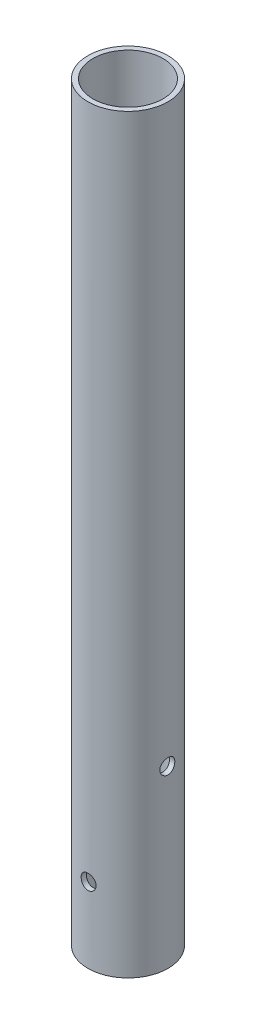
from build123d import *

# Parameters (mm, degrees)
SKETCH_1_R               = 8
SKETCH_1_R_2             = 7
EXTRUDE_1_DEPTH          = 150
CUT_EXTRUDE_1_DEPTH      = 151.426061572
CUT_EXTRUDE_1_DEPTH_BACK = 151.426061572
SKETCH_2_R               = 1.5
CUT_EXTRUDE_2_DEPTH      = 151.426061684
CUT_EXTRUDE_2_DEPTH_BACK = 151.426061684
SKETCH_4_R               = 1.5


with BuildPart() as part:
    # 草图1 → 凸台-拉伸1 (new body)
    with BuildSketch(Plane(origin=(0, 0, 0), x_dir=(1, 0, 0), z_dir=(0, 1, 0))):
        with Locations(Location((0, 0, 0), (0, 0, 270))):
            Circle(SKETCH_1_R)
        with Locations(Location((0, 0, 0), (0, 0, 270))):
            Circle(SKETCH_1_R_2, mode=Mode.SUBTRACT)
    extrude(amount=EXTRUDE_1_DEPTH)

    # 草图2 → 切除-拉伸1 (cut, two sides: drawn at the far end of the back side and taken through both)
    with BuildSketch(Plane.XY.offset(-CUT_EXTRUDE_1_DEPTH_BACK)):
        with Locations((0, 15)):
            Circle(SKETCH_2_R)
    extrude(amount=CUT_EXTRUDE_1_DEPTH + CUT_EXTRUDE_1_DEPTH_BACK, mode=Mode.SUBTRACT)

    # 草图4 → 切除-拉伸2 (cut, two sides: drawn at the far end of the back side and taken through both)
    with BuildSketch(Plane(origin=(0, 0, 0), x_dir=(0, 0, -1), z_dir=(1, 0, 0)).offset(-CUT_EXTRUDE_2_DEPTH_BACK)):
        with Locations((0, 35)):
            Circle(SKETCH_4_R)
    extrude(amount=CUT_EXTRUDE_2_DEPTH + CUT_EXTRUDE_2_DEPTH_BACK, mode=Mode.SUBTRACT)


solid = part.part
